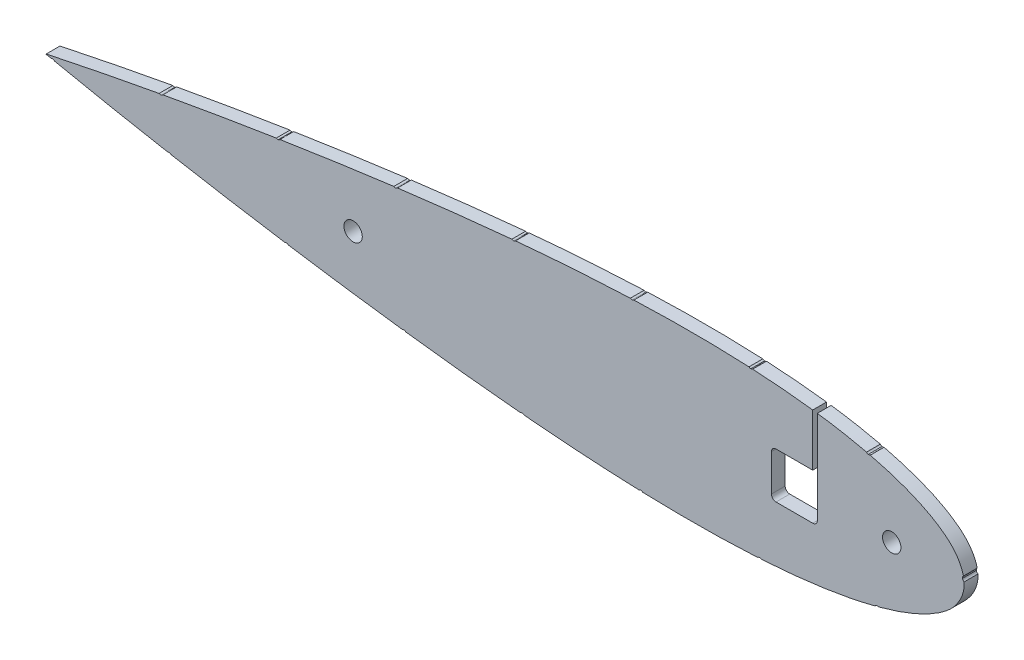
from build123d import *

# Parameters (mm, degrees)
SKETCH1_R           = 2
BOSS_EXTRUDE1_DEPTH = 3
SKETCH2_W           = 1
SKETCH2_H           = 17.978666844
CUT_EXTRUDE1_DEPTH  = 10


with BuildPart() as part:
    # Sketch1 → Boss-Extrude1 (new body)
    with BuildSketch(Plane.XY):
        with BuildLine():
            Line((-200, -0.026021313), (-200, 0.026021305))
            add(Edge.make_bspline(
                [(-200, 0.026021305), (-196.133660298, 0.824460007), (-188.973100367, 2.314029776), (-175.197231938, 4.95350612), (-158.682087923, 7.864416996), (-138.848303334, 10.963035098), (-119.017582397, 13.652387002), (-99.186590163, 15.851924276), (-79.350823181, 17.41083287), (-62.801573061, 17.964567123), (-49.570059005, 17.74356646), (-39.638389621, 17.155457266), (-29.688048318, 16.020003739), (-21.406431266, 14.43331701), (-14.801094645, 12.546196453), (-9.75689383, 10.639636938), (-5.531834741, 8.343752603), (-1.645401824, 5.168264306), (1.073716587, 0), (-1.645401824, -5.168264306), (-5.53183474, -8.343752603), (-9.756893829, -10.639636938), (-14.801094645, -12.546196453), (-21.406431266, -14.43331701), (-29.688048318, -16.02000374), (-39.63838962, -17.155457267), (-49.570059005, -17.743566462), (-62.801573061, -17.964567125), (-79.350823181, -17.410832873), (-99.186590162, -15.85192428), (-119.017582396, -13.652387007), (-138.848303334, -10.963035103), (-158.682087923, -7.864417002), (-175.197231937, -4.953506127), (-188.973100367, -2.314029784), (-196.133660298, -0.824460015), (-200, -0.026021313)],
                knots=[-0.004189875, -0.004189875, -0.004189875, -0.004189875, 0.024603844, 0.049152359, 0.098108667, 0.146905312, 0.195554797, 0.244056277, 0.292409554, 0.340643731, 0.364754111, 0.3889056, 0.413178108, 0.437756239, 0.450304697, 0.463229879, 0.477067953, 0.485035559, 0.5, 0.514964441, 0.522932047, 0.536770121, 0.549695303, 0.562243761, 0.586821892, 0.6110944, 0.635245889, 0.659356269, 0.707590446, 0.755943723, 0.804445203, 0.853094688, 0.901891333, 0.950847641, 0.975396156, 1.004189875, 1.004189875, 1.004189875, 1.004189875], degree=3))
        make_face()
        with Locations((-133.108640526, 0)):
            Circle(SKETCH1_R, mode=Mode.SUBTRACT)
        with Locations((-15.792378059, 0)):
            Circle(SKETCH1_R, mode=Mode.SUBTRACT)
        with BuildLine():
            Line((-32, -4), (-32, 4))
            ThreePointArc((-32, 4), (-32.292893219, 4.707106781), (-33, 5))
            Line((-33, 5), (-41, 5))
            ThreePointArc((-41, 5), (-41.707106781, 4.707106781), (-42, 4))
            Line((-42, 4), (-42, -4))
            ThreePointArc((-42, -4), (-41.707106781, -4.707106781), (-41, -5))
            Line((-41, -5), (-33, -5))
            ThreePointArc((-33, -5), (-32.292893219, -4.707106781), (-32, -4))
        make_face(mode=Mode.SUBTRACT)
    extrude(amount=BOSS_EXTRUDE1_DEPTH)

    # Sketch2 → Cut-Extrude1 (cut)
    with BuildSketch(Plane.XY.offset(3)):
        with Locations((-32.5, 11.321644193)):
            Rectangle(SKETCH2_W, SKETCH2_H)
        with BuildLine():
            add(Edge.make_bspline(
                [(-198.698716016, -1.42218076), (-198.657778251, -1.428824714), (-198.577801143, -1.441804518), (-198.456443716, -1.429500865), (-198.340152416, -1.395058585), (-198.231567162, -1.336603625), (-198.135060868, -1.260229332), (-198.058638463, -1.165294941), (-197.998864973, -1.057968244), (-197.978922981, -0.978027066), (-197.968754168, -0.93726349)],
                knots=[0, 0, 0, 0, 1.017083743, 1.987001844, 2.972391076, 3.986042786, 5.004656253, 5.979834707, 6.969878046, 8, 8, 8, 8], degree=3))
            add(Edge.make_bspline(
                [(-197.968754168, -0.93726349), (-197.962244326, -0.896346586), (-197.949457917, -0.815979), (-197.960020188, -0.694255872), (-197.996866616, -0.578352688), (-198.053356638, -0.468616036), (-198.129812011, -0.371935529), (-198.220976357, -0.29162283), (-198.328120385, -0.233724306), (-198.40662668, -0.212879634), (-198.446642127, -0.202254896)],
                knots=[0, 0, 0, 0, 1.019051807, 2.001586779, 2.979565923, 4.002845271, 5.029175072, 6.001582509, 6.981386527, 8, 8, 8, 8], degree=3))
            add(Edge.make_bspline(
                [(-198.446642127, -0.202254896), (-198.487587346, -0.195487057), (-198.567815263, -0.182226176), (-198.688931563, -0.196373323), (-198.805135937, -0.23159725), (-198.913393811, -0.29097891), (-199.00985413, -0.368622999), (-199.090301245, -0.460772688), (-199.146699034, -0.569654911), (-199.167796095, -0.64799544), (-199.178554798, -0.687946147)],
                knots=[0, 0, 0, 0, 1.017323363, 1.993339767, 2.969660132, 3.993090107, 5.011943554, 6.005958459, 6.983114227, 8, 8, 8, 8], degree=3))
            add(Edge.make_bspline(
                [(-199.178554798, -0.687946147), (-199.184698424, -0.729527004), (-199.196742327, -0.811041702), (-199.187056704, -0.934091433), (-199.15165593, -1.051130615), (-199.093558972, -1.159956573), (-199.016694835, -1.255336782), (-198.924848993, -1.334354229), (-198.817023536, -1.390345997), (-198.738672223, -1.411429149), (-198.698716016, -1.42218076)],
                knots=[0, 0, 0, 0, 1.03204317, 2.023207143, 3.008371278, 4.021791435, 5.040172216, 6.006883534, 6.98358598, 8, 8, 8, 8], degree=3))
        make_face()
        with BuildLine():
            add(Edge.make_bspline(
                [(-173.314476827, -6.388594177), (-173.27383976, -6.394547538), (-173.194310919, -6.406198573), (-173.07471371, -6.392626373), (-172.959485846, -6.358924655), (-172.852952065, -6.299031619), (-172.759020556, -6.220685562), (-172.681130424, -6.127606238), (-172.625977419, -6.018285902), (-172.605797416, -5.939174964), (-172.595480194, -5.898728732)],
                knots=[0, 0, 0, 0, 1.014936559, 1.986283321, 2.958172497, 3.976367764, 4.993083094, 5.978741162, 6.966611879, 8, 8, 8, 8], degree=3))
            add(Edge.make_bspline(
                [(-172.595480194, -5.898728732), (-172.589470542, -5.858086871), (-172.57761195, -5.777890019), (-172.592328787, -5.657687345), (-172.626324105, -5.541650662), (-172.685255776, -5.433954124), (-172.762956357, -5.339144487), (-172.854200786, -5.259991861), (-172.961576286, -5.203444427), (-173.039926545, -5.183841072), (-173.079964383, -5.173823543)],
                knots=[0, 0, 0, 0, 1.014921097, 2.002700549, 2.974574918, 4.000782688, 5.023610173, 6.001739072, 6.978866854, 8, 8, 8, 8], degree=3))
            add(Edge.make_bspline(
                [(-173.079964383, -5.173823543), (-173.120595835, -5.167862414), (-173.200772149, -5.156099573), (-173.321037046, -5.170106506), (-173.436478112, -5.206717149), (-173.542378614, -5.268073584), (-173.638992951, -5.34429013), (-173.713596434, -5.439483616), (-173.771876546, -5.545893336), (-173.790142797, -5.624759087), (-173.799481331, -5.665078826)],
                knots=[0, 0, 0, 0, 1.014449737, 2.001770434, 2.971023001, 3.99807325, 5.020425703, 6.001709555, 6.978383529, 8, 8, 8, 8], degree=3))
            add(Edge.make_bspline(
                [(-173.799481331, -5.665078826), (-173.805605356, -5.706160061), (-173.81768626, -5.787201286), (-173.804357912, -5.908925769), (-173.767901421, -6.025025296), (-173.709928304, -6.132667289), (-173.63224173, -6.226546831), (-173.540623236, -6.30397201), (-173.432640285, -6.358616665), (-173.354458092, -6.378451119), (-173.314476827, -6.388594177)],
                knots=[0, 0, 0, 0, 1.025765707, 2.023534839, 3.0019132, 4.027092756, 5.032139768, 6.005204792, 6.979889984, 8, 8, 8, 8], degree=3))
        make_face()
        with BuildLine():
            add(Edge.make_bspline(
                [(-147.766049435, -10.680380496), (-147.724906193, -10.684693128), (-147.644705822, -10.693099725), (-147.52436874, -10.67833883), (-147.410562319, -10.637724911), (-147.304155217, -10.575801485), (-147.211619457, -10.493919138), (-147.137731216, -10.396834669), (-147.084144842, -10.285918744), (-147.067192483, -10.205369326), (-147.058491793, -10.164027851)],
                knots=[0, 0, 0, 0, 1.016544963, 1.981547422, 2.95626941, 3.974200754, 4.995989429, 5.978674654, 6.962567667, 8, 8, 8, 8], degree=3))
            add(Edge.make_bspline(
                [(-147.058491793, -10.164027851), (-147.054231589, -10.122881772), (-147.045880715, -10.042227016), (-147.060150268, -9.921077354), (-147.099683593, -9.805867536), (-147.162621366, -9.699841354), (-147.242197197, -9.605526819), (-147.338127659, -9.530580365), (-147.447946942, -9.477942159), (-147.526737739, -9.460232562), (-147.566939675, -9.451196481)],
                knots=[0, 0, 0, 0, 1.018597505, 1.996660093, 2.983144274, 4.003130959, 5.022898425, 6.011721769, 6.985507986, 8, 8, 8, 8], degree=3))
            add(Edge.make_bspline(
                [(-147.566939675, -9.451196481), (-147.608104048, -9.446795746), (-147.689000444, -9.438147405), (-147.809698903, -9.454474268), (-147.924804559, -9.494023442), (-148.029163117, -9.559784023), (-148.124062563, -9.639259237), (-148.196686925, -9.73716852), (-148.252638694, -9.845813978), (-148.26895623, -9.925682955), (-148.277325984, -9.966650155)],
                knots=[0, 0, 0, 0, 1.016415999, 1.997464924, 2.972063253, 3.990885665, 5.018844379, 6.001404936, 6.974860488, 8, 8, 8, 8], degree=3))
            add(Edge.make_bspline(
                [(-148.277325984, -9.966650155), (-148.282127643, -10.008740234), (-148.291458405, -10.090531251), (-148.275059019, -10.213067165), (-148.233986441, -10.328093781), (-148.171761803, -10.434570666), (-148.091404406, -10.527295465), (-147.994933668, -10.600495534), (-147.886313223, -10.655710776), (-147.806503136, -10.672082225), (-147.766049435, -10.680380496)],
                knots=[0, 0, 0, 0, 1.038609022, 2.0182639, 3.008511575, 4.024867508, 5.034649745, 6.004359402, 6.988460601, 8, 8, 8, 8], degree=3))
        make_face()
        with BuildLine():
            add(Edge.make_bspline(
                [(-122.131403372, -14.298809703), (-122.090349434, -14.301906436), (-122.00985955, -14.307977855), (-121.890507949, -14.287873332), (-121.777914523, -14.245051666), (-121.674548945, -14.179883685), (-121.583890754, -14.097124207), (-121.513904876, -13.998110627), (-121.461252672, -13.887203533), (-121.447289905, -13.80628492), (-121.440104846, -13.76464525)],
                knots=[0, 0, 0, 0, 1.015022789, 1.990042171, 2.964140273, 3.976505931, 4.994472955, 5.978125389, 6.959569504, 8, 8, 8, 8], degree=3))
            add(Edge.make_bspline(
                [(-121.440104846, -13.76464525), (-121.436796637, -13.723101712), (-121.430347563, -13.642116082), (-121.451077465, -13.522033203), (-121.492565068, -13.408493059), (-121.558727606, -13.304837331), (-121.640421569, -13.213621595), (-121.737129573, -13.140989579), (-121.847680145, -13.09201763), (-121.926610678, -13.076851541), (-121.967037178, -13.0690838)],
                knots=[0, 0, 0, 0, 1.02917971, 2.006299243, 2.992527683, 4.007073935, 5.033914597, 6.012801283, 6.982200093, 8, 8, 8, 8], degree=3))
            add(Edge.make_bspline(
                [(-121.967037178, -13.0690838), (-122.007941176, -13.065491161), (-122.088690478, -13.058398869), (-122.208994441, -13.077700299), (-122.322055218, -13.122630734), (-122.425267693, -13.189038454), (-122.516406493, -13.271779882), (-122.586308025, -13.370869315), (-122.638664005, -13.480824268), (-122.652409735, -13.560774114), (-122.659401435, -13.601440223)],
                knots=[0, 0, 0, 0, 1.012413812, 1.99862393, 2.97981436, 4.00105753, 5.018998664, 6.002626082, 6.984045237, 8, 8, 8, 8], degree=3))
            add(Edge.make_bspline(
                [(-122.659401435, -13.601440223), (-122.662611946, -13.643411038), (-122.668855355, -13.725030757), (-122.651724176, -13.846857056), (-122.607146648, -13.959983741), (-122.5420821, -14.064112185), (-122.459385096, -14.15418794), (-122.361353863, -14.224769707), (-122.251538591, -14.276206375), (-122.171902617, -14.291189808), (-122.131403372, -14.298809703)],
                knots=[0, 0, 0, 0, 1.037472026, 2.017548995, 3.007322432, 4.018277869, 5.034826871, 6.005725454, 6.985802423, 8, 8, 8, 8], degree=3))
        make_face()
        with BuildLine():
            add(Edge.make_bspline(
                [(-96.365247494, -17.114692511), (-96.323889926, -17.116481886), (-96.242916598, -17.119985275), (-96.124245578, -17.093652731), (-96.012464882, -17.047011888), (-95.911953089, -16.976062033), (-95.824468836, -16.888838226), (-95.758904794, -16.785317527), (-95.712074014, -16.670858712), (-95.700781035, -16.58893628), (-95.695018768, -16.547135184)],
                knots=[0, 0, 0, 0, 1.013456929, 1.984231283, 2.958728731, 3.973133191, 4.988120307, 5.974751867, 6.966612828, 8, 8, 8, 8], degree=3))
            add(Edge.make_bspline(
                [(-95.695018768, -16.547135184), (-95.693311564, -16.505796153), (-95.689950059, -16.424399108), (-95.715381359, -16.305021015), (-95.762879061, -16.192748204), (-95.832943542, -16.090908781), (-95.919821907, -16.002641888), (-96.021016968, -15.935256492), (-96.133896413, -15.888820393), (-96.21436451, -15.877789682), (-96.255674559, -15.872126826)],
                knots=[0, 0, 0, 0, 1.015443082, 1.999419494, 2.975826744, 4.000868901, 5.024752326, 6.006841917, 6.976768938, 8, 8, 8, 8], degree=3))
            add(Edge.make_bspline(
                [(-96.255674559, -15.872126826), (-96.296994639, -15.870468906), (-96.378354368, -15.867204443), (-96.497870331, -15.891899187), (-96.608995348, -15.941996722), (-96.709263444, -16.013444952), (-96.796254293, -16.101067165), (-96.864095069, -16.202174354), (-96.910191921, -16.315760548), (-96.921385786, -16.396669603), (-96.927098192, -16.437958769)],
                knots=[0, 0, 0, 0, 1.015229926, 1.998999788, 2.971853695, 3.996680681, 5.013443471, 5.995326907, 6.976983728, 8, 8, 8, 8], degree=3))
            add(Edge.make_bspline(
                [(-96.927098192, -16.437958769), (-96.929088262, -16.480273847), (-96.932962254, -16.562646983), (-96.907142264, -16.68368082), (-96.859159195, -16.796150485), (-96.788233478, -16.89753663), (-96.700638344, -16.984089119), (-96.599963773, -17.05162614), (-96.487010103, -17.097982189), (-96.406552272, -17.109023972), (-96.365247494, -17.114692511)],
                knots=[0, 0, 0, 0, 1.036141522, 2.017016871, 3.007168552, 4.020357798, 5.034129003, 6.013123477, 6.979993714, 8, 8, 8, 8], degree=3))
        make_face()
        with BuildLine():
            add(Edge.make_bspline(
                [(-70.495134128, -18.754112945), (-70.453563783, -18.753306935), (-70.372581357, -18.751736763), (-70.256018236, -18.718317424), (-70.14731119, -18.66586755), (-70.051055215, -18.589089289), (-69.970970199, -18.495780371), (-69.910034508, -18.390197328), (-69.870921185, -18.27326703), (-69.864944583, -18.190812229), (-69.861891672, -18.148693458)],
                knots=[0, 0, 0, 0, 1.020035374, 1.987112173, 2.958782459, 3.976632821, 4.995139179, 5.970468678, 6.963294272, 8, 8, 8, 8], degree=3))
            add(Edge.make_bspline(
                [(-69.861891672, -18.148693458), (-69.862763045, -18.107137572), (-69.864470391, -18.025714028), (-69.897272234, -17.908515103), (-69.949965615, -17.799283449), (-70.027175146, -17.703664131), (-70.118563259, -17.621344993), (-70.223317709, -17.559404315), (-70.338980693, -17.520406008), (-70.419959905, -17.514441572), (-70.461086241, -17.511412457)],
                knots=[0, 0, 0, 0, 1.022793349, 2.004035206, 2.978332697, 3.998935126, 5.017854659, 6.001223378, 6.984895559, 8, 8, 8, 8], degree=3))
            add(Edge.make_bspline(
                [(-70.461086241, -17.511412457), (-70.502628251, -17.512280421), (-70.583555477, -17.513971287), (-70.701008752, -17.546656982), (-70.80825146, -17.602659275), (-70.903922986, -17.680289293), (-70.985652353, -17.772171156), (-71.04596229, -17.877972258), (-71.085323848, -17.993199005), (-71.091228911, -18.07420924), (-71.094227874, -18.115351331)],
                knots=[0, 0, 0, 0, 1.023280882, 1.993434686, 2.980682337, 3.992734567, 5.021837862, 6.000270626, 6.984411691, 8, 8, 8, 8], degree=3))
            add(Edge.make_bspline(
                [(-71.094227874, -18.115351331), (-71.093357365, -18.157381129), (-71.091651756, -18.239731086), (-71.059358958, -18.358847881), (-71.00507588, -18.468579405), (-70.928283959, -18.564990652), (-70.836387945, -18.645423589), (-70.732238432, -18.706242958), (-70.617247292, -18.74514349), (-70.536263028, -18.751091945), (-70.495134128, -18.754112945)],
                knots=[0, 0, 0, 0, 1.032763593, 2.023517646, 3.012470053, 4.030960965, 5.040364569, 6.005358633, 6.986995702, 8, 8, 8, 8], degree=3))
        make_face()
        with BuildLine():
            add(Edge.make_bspline(
                [(-44.540683937, -18.522989647), (-44.499767552, -18.518202882), (-44.4194148, -18.508802499), (-44.305113986, -18.467034113), (-44.20223296, -18.402780755), (-44.112947554, -18.318480934), (-44.039071245, -18.2200379), (-43.991170952, -18.107590796), (-43.961111193, -17.987963005), (-43.963086345, -17.905125102), (-43.96409121, -17.86298103)],
                knots=[0, 0, 0, 0, 1.011046661, 1.985522006, 2.965834628, 3.976294835, 4.992604354, 5.969661498, 6.9670582, 8, 8, 8, 8], degree=3))
            add(Edge.make_bspline(
                [(-43.96409121, -17.86298103), (-43.968949565, -17.822096869), (-43.978547557, -17.741327591), (-44.019458637, -17.62656265), (-44.085224681, -17.524161806), (-44.168575899, -17.433682412), (-44.267117627, -17.359100024), (-44.378044537, -17.308520344), (-44.496234228, -17.278880964), (-44.577593441, -17.280459107), (-44.618739646, -17.281257229)],
                knots=[0, 0, 0, 0, 1.013655101, 2.002540536, 2.974332368, 3.99727618, 5.024579147, 6.000042749, 6.988551538, 8, 8, 8, 8], degree=3))
            add(Edge.make_bspline(
                [(-44.618739646, -17.281257229), (-44.659627562, -17.286091807), (-44.739924407, -17.295586088), (-44.854410883, -17.336588602), (-44.955816552, -17.403427683), (-45.044364834, -17.488408658), (-45.118356461, -17.587328618), (-45.167561087, -17.698394216), (-45.198469601, -17.816687049), (-45.196511771, -17.898126906), (-45.195510123, -17.939792488)],
                knots=[0, 0, 0, 0, 1.014489377, 1.99228291, 2.970152734, 3.991311874, 5.01108203, 5.99776167, 6.975631494, 8, 8, 8, 8], degree=3))
            add(Edge.make_bspline(
                [(-45.195510123, -17.939792488), (-45.190647774, -17.981705377), (-45.181153364, -18.063546097), (-45.138921979, -18.179627975), (-45.075177081, -18.284407996), (-44.988737, -18.372848558), (-44.890947545, -18.446248649), (-44.780665241, -18.495804332), (-44.663201553, -18.525389171), (-44.581834239, -18.523795581), (-44.540683937, -18.522989647)],
                knots=[0, 0, 0, 0, 1.035623612, 2.0221985, 3.013794921, 4.031730307, 5.048281094, 6.004715682, 6.990914804, 8, 8, 8, 8], degree=3))
        make_face()
        with BuildLine():
            add(Edge.make_bspline(
                [(-18.766047409, -14.776053106), (-18.726430121, -14.763093483), (-18.649060915, -14.737784437), (-18.545436998, -14.673336124), (-18.457066041, -14.590781911), (-18.385859349, -14.491047634), (-18.33490107, -14.379094323), (-18.306568202, -14.260154785), (-18.304516006, -14.136522259), (-18.321060429, -14.05579838), (-18.329530252, -14.01447225)],
                knots=[0, 0, 0, 0, 1.021838797, 1.995564641, 2.972021413, 3.978690765, 4.988295019, 5.978293441, 6.964998844, 8, 8, 8, 8], degree=3))
            add(Edge.make_bspline(
                [(-18.329530252, -14.01447225), (-18.34227244, -13.975300664), (-18.36745469, -13.897886276), (-18.431918143, -13.79422239), (-18.515183566, -13.705230898), (-18.615636383, -13.633033054), (-18.727185937, -13.579965836), (-18.845467521, -13.54981877), (-18.967679832, -13.544803999), (-19.047482934, -13.562269914), (-19.088120926, -13.571164051)],
                knots=[0, 0, 0, 0, 1.010663379, 1.997363258, 2.974631646, 3.993181824, 5.023377087, 5.996390516, 6.979705479, 8, 8, 8, 8], degree=3))
            add(Edge.make_bspline(
                [(-19.088120926, -13.571164051), (-19.127264944, -13.583939206), (-19.204624849, -13.609186608), (-19.308379598, -13.67298178), (-19.395974382, -13.758014954), (-19.465768415, -13.860099358), (-19.517068622, -13.973075268), (-19.546684988, -14.091529983), (-19.549850578, -14.213849601), (-19.532681024, -14.293401127), (-19.523910337, -14.33403826)],
                knots=[0, 0, 0, 0, 1.010480825, 1.99700248, 2.965261353, 3.994047373, 5.021320419, 6.003025338, 6.979889772, 8, 8, 8, 8], degree=3))
            add(Edge.make_bspline(
                [(-19.523910337, -14.33403826), (-19.511276621, -14.374391151), (-19.486617909, -14.453152637), (-19.420850809, -14.557776425), (-19.338357962, -14.647946032), (-19.236619635, -14.717636463), (-19.125101505, -14.768833403), (-19.007657006, -14.797723453), (-18.885829244, -14.802214534), (-18.80668766, -14.784929302), (-18.766047409, -14.776053106)],
                knots=[0, 0, 0, 0, 1.036080969, 2.022241198, 3.010800118, 4.022960242, 5.032851028, 6.014196287, 6.980263503, 8, 8, 8, 8], degree=3))
        make_face()
        with BuildLine():
            add(Edge.make_bspline(
                [(0.855774028, 1.068338446), (0.848776003, 1.109017523), (0.835035451, 1.188890479), (0.78327878, 1.298374183), (0.712926067, 1.396822882), (0.621653965, 1.478522501), (0.518436797, 1.545091294), (0.404937176, 1.588408087), (0.283332954, 1.605749781), (0.201396156, 1.599432712), (0.159309605, 1.596187971)],
                knots=[0, 0, 0, 0, 1.014719943, 1.992392375, 2.958557865, 3.98503947, 4.996226357, 5.975727355, 6.960239397, 8, 8, 8, 8], degree=3))
            add(Edge.make_bspline(
                [(0.159309605, 1.596187971), (0.118639917, 1.589162661), (0.038302384, 1.575285101), (-0.072130602, 1.523321478), (-0.171394371, 1.452959938), (-0.254449583, 1.362297028), (-0.322423721, 1.259605278), (-0.364316198, 1.146121896), (-0.385650752, 1.02690946), (-0.379407755, 0.946518486), (-0.376209444, 0.905333887)],
                knots=[0, 0, 0, 0, 1.016640156, 2.008236801, 2.98768293, 4.009609709, 5.03175617, 6.013110734, 6.982109138, 8, 8, 8, 8], degree=3))
            add(Edge.make_bspline(
                [(-0.376209444, 0.905333887), (-0.368562841, 0.864832411), (-0.353454214, 0.784807118), (-0.302341696, 0.674580449), (-0.231436564, 0.575930605), (-0.140280064, 0.493423562), (-0.035300569, 0.428684278), (0.077771468, 0.382709194), (0.198956509, 0.366210797), (0.279915093, 0.371787366), (0.321030895, 0.374619494)],
                knots=[0, 0, 0, 0, 1.01379397, 2.003116137, 2.968889617, 3.994954739, 5.014025868, 6.000331341, 6.98444393, 8, 8, 8, 8], degree=3))
            add(Edge.make_bspline(
                [(0.321030895, 0.374619494), (0.362676432, 0.381847444), (0.443988007, 0.395959783), (0.555283589, 0.44829647), (0.655038134, 0.518552357), (0.736863711, 0.610330705), (0.803725396, 0.71347278), (0.845996987, 0.826872206), (0.866781689, 0.946649682), (0.859485948, 1.027303489), (0.855774028, 1.068338446)],
                knots=[0, 0, 0, 0, 1.037152729, 2.025007431, 3.000757468, 4.025300625, 5.034577948, 6.012229218, 6.988664126, 8, 8, 8, 8], degree=3))
        make_face()
        with BuildLine():
            add(Edge.make_bspline(
                [(-20.620263047, 15.240646492), (-20.660968044, 15.248471876), (-20.740805911, 15.263820407), (-20.862343223, 15.255145249), (-20.979137547, 15.223438843), (-21.088342471, 15.167878717), (-21.18663641, 15.094293296), (-21.267330025, 15.003075966), (-21.330029155, 14.896979313), (-21.352633363, 14.817681841), (-21.364200928, 14.777101842)],
                knots=[0, 0, 0, 0, 1.01727483, 1.995260003, 2.969823377, 3.981243339, 4.994936076, 5.976104161, 6.964283641, 8, 8, 8, 8], degree=3))
            add(Edge.make_bspline(
                [(-21.364200928, 14.777101842), (-21.372052259, 14.736390863), (-21.387451684, 14.656541262), (-21.378379065, 14.534720259), (-21.347814614, 14.416977913), (-21.292753557, 14.306559179), (-21.220331261, 14.206702631), (-21.128989723, 14.126390564), (-21.023862583, 14.064400271), (-20.945890812, 14.041139244), (-20.906010177, 14.029241803)],
                knots=[0, 0, 0, 0, 1.01783833, 1.996365239, 2.980496325, 3.999721009, 5.019310209, 6.001021793, 6.977572031, 8, 8, 8, 8], degree=3))
            add(Edge.make_bspline(
                [(-20.906010177, 14.029241803), (-20.865054423, 14.021865038), (-20.785298439, 14.00749975), (-20.664208802, 14.017052991), (-20.547295388, 14.04831001), (-20.437806775, 14.105422301), (-20.339477072, 14.180094075), (-20.258025298, 14.270747081), (-20.198512309, 14.376784501), (-20.17523302, 14.45412575), (-20.163392118, 14.493465017)],
                knots=[0, 0, 0, 0, 1.024379987, 1.994846304, 2.972367305, 3.996747292, 5.024548318, 6.008694075, 6.987131501, 8, 8, 8, 8], degree=3))
            add(Edge.make_bspline(
                [(-20.163392118, 14.493465017), (-20.156182881, 14.534823912), (-20.142042213, 14.615947945), (-20.14558745, 14.73899923), (-20.179313343, 14.856383121), (-20.232813996, 14.966773095), (-20.307145225, 15.065080268), (-20.397857104, 15.145453944), (-20.502571059, 15.207689272), (-20.580566337, 15.229530245), (-20.620263047, 15.240646492)],
                knots=[0, 0, 0, 0, 1.032581978, 2.025373636, 2.999756313, 4.018227857, 5.031732643, 6.012718807, 6.988547439, 8, 8, 8, 8], degree=3))
        make_face()
        with BuildLine():
            add(Edge.make_bspline(
                [(-46.428550572, 18.627149519), (-46.469652033, 18.627131816), (-46.550754027, 18.627096885), (-46.668657977, 18.598506219), (-46.777118782, 18.544596171), (-46.874361663, 18.470331718), (-46.958809779, 18.380566366), (-47.021658824, 18.27582356), (-47.06166974, 18.159357034), (-47.069944692, 18.07740467), (-47.074182522, 18.035434605)],
                knots=[0, 0, 0, 0, 1.01019419, 1.993329679, 2.957234023, 3.974902007, 4.993956114, 5.975579086, 6.963238228, 8, 8, 8, 8], degree=3))
            add(Edge.make_bspline(
                [(-47.074182522, 18.035434605), (-47.074182334, 17.994327037), (-47.074181964, 17.913212994), (-47.045238108, 17.794984657), (-46.991807227, 17.685533842), (-46.918245034, 17.586615576), (-46.827698758, 17.50289722), (-46.725085968, 17.438113277), (-46.610656359, 17.396526344), (-46.530003035, 17.388566731), (-46.488991622, 17.384519347)],
                knots=[0, 0, 0, 0, 1.01271472, 1.998303225, 2.974988035, 4.004157658, 5.025754401, 6.004043277, 6.985075879, 8, 8, 8, 8], degree=3))
            add(Edge.make_bspline(
                [(-46.488991622, 17.384519347), (-46.447852239, 17.385169853), (-46.36674809, 17.386452291), (-46.247962807, 17.414556896), (-46.139416368, 17.469806752), (-46.040766261, 17.543643895), (-45.958709686, 17.6358917), (-45.896050179, 17.740024325), (-45.853763045, 17.854346378), (-45.845888092, 17.935044819), (-45.841883757, 17.976079173)],
                knots=[0, 0, 0, 0, 1.01357222, 1.998204819, 2.980412583, 3.999630263, 5.022861345, 6.005979124, 6.986060238, 8, 8, 8, 8], degree=3))
            add(Edge.make_bspline(
                [(-45.841883757, 17.976079173), (-45.841549551, 18.018224298), (-45.840892639, 18.101064269), (-45.872350667, 18.219935913), (-45.92291771, 18.330781664), (-45.998302676, 18.427688743), (-46.087782374, 18.512292394), (-46.192215398, 18.574745137), (-46.30706035, 18.614847182), (-46.387559593, 18.622998693), (-46.428550572, 18.627149519)],
                knots=[0, 0, 0, 0, 1.033356646, 2.031153917, 2.998154051, 4.014871735, 5.032974247, 6.013680577, 6.988547287, 8, 8, 8, 8], degree=3))
        make_face()
        with BuildLine():
            add(Edge.make_bspline(
                [(-72.375466935, 18.701431712), (-72.416573629, 18.698058263), (-72.497514168, 18.691415822), (-72.612078833, 18.651417635), (-72.716264169, 18.589895011), (-72.806407704, 18.506984575), (-72.882364089, 18.410289026), (-72.936578037, 18.300947013), (-72.967403505, 18.181831279), (-72.968433667, 18.099488582), (-72.968959442, 18.05746249)],
                knots=[0, 0, 0, 0, 1.013395961, 1.995412564, 2.960779728, 3.977984359, 4.996869055, 5.975699992, 6.966837105, 8, 8, 8, 8], degree=3))
            add(Edge.make_bspline(
                [(-72.968959442, 18.05746249), (-72.96544176, 18.016401612), (-72.958525586, 17.935671133), (-72.920533908, 17.820131385), (-72.858731251, 17.715176467), (-72.776379519, 17.623952721), (-72.679986496, 17.54717695), (-72.572271011, 17.492109277), (-72.454533598, 17.460451622), (-72.373595129, 17.459467424), (-72.332047348, 17.45896221)],
                knots=[0, 0, 0, 0, 1.015964745, 1.997505321, 2.976300749, 4.005785491, 5.018212846, 6.00582643, 6.97633983, 8, 8, 8, 8], degree=3))
            add(Edge.make_bspline(
                [(-72.332047348, 17.45896221), (-72.290927417, 17.462314826), (-72.209960816, 17.468916245), (-72.095162787, 17.509362195), (-71.989926998, 17.570092345), (-71.899901647, 17.653680603), (-71.822651796, 17.749958703), (-71.772872357, 17.860583043), (-71.737603749, 17.977179856), (-71.737103787, 18.05845187), (-71.736847667, 18.100085831)],
                knots=[0, 0, 0, 0, 1.015395747, 1.999350215, 2.977597462, 3.996809397, 5.01770471, 6.002872438, 6.976913138, 8, 8, 8, 8], degree=3))
            add(Edge.make_bspline(
                [(-71.736847667, 18.100085831), (-71.740268663, 18.142175575), (-71.746965854, 18.224573552), (-71.787093598, 18.341168524), (-71.848968775, 18.446175141), (-71.929788951, 18.538937397), (-72.027195267, 18.614447229), (-72.135608698, 18.668057343), (-72.252949805, 18.700020208), (-72.333908679, 18.700952925), (-72.375466935, 18.701431712)],
                knots=[0, 0, 0, 0, 1.035907175, 2.027968017, 3.002546241, 4.020268065, 5.037334399, 6.014418458, 6.980750337, 8, 8, 8, 8], degree=3))
        make_face()
        with BuildLine():
            add(Edge.make_bspline(
                [(-98.246170693, 16.940744336), (-98.287474331, 16.934894979), (-98.367929942, 16.923500981), (-98.480027991, 16.876017968), (-98.582064347, 16.810221026), (-98.667489943, 16.721123441), (-98.737920037, 16.619878198), (-98.786699208, 16.507563478), (-98.810620817, 16.386035098), (-98.806475884, 16.303267389), (-98.804358479, 16.260986172)],
                knots=[0, 0, 0, 0, 1.019584346, 1.986054622, 2.959890179, 3.980124563, 4.992894689, 5.972537486, 6.964287093, 8, 8, 8, 8], degree=3))
            add(Edge.make_bspline(
                [(-98.804358479, 16.260986172), (-98.798485917, 16.219698855), (-98.787046717, 16.139275038), (-98.739636586, 16.02634383), (-98.672217104, 15.924973695), (-98.584123545, 15.837846737), (-98.484047095, 15.76631129), (-98.371739595, 15.719463851), (-98.252868253, 15.692630151), (-98.171246886, 15.696717458), (-98.129888846, 15.698788522)],
                knots=[0, 0, 0, 0, 1.02339542, 1.993478236, 2.986919853, 4.004059474, 5.029266278, 5.99566988, 6.984393811, 8, 8, 8, 8], degree=3))
            add(Edge.make_bspline(
                [(-98.129888846, 15.698788522), (-98.088519024, 15.704477636), (-98.007832569, 15.715573513), (-97.89658212, 15.76539404), (-97.794254516, 15.830671391), (-97.70844291, 15.920010188), (-97.638807347, 16.022025993), (-97.591947885, 16.134604948), (-97.567153465, 16.254105182), (-97.570955631, 16.335484729), (-97.572886632, 16.376814874)],
                knots=[0, 0, 0, 0, 1.023518922, 1.996240499, 2.973834088, 3.998005556, 5.023336082, 6.00001802, 6.984271248, 8, 8, 8, 8], degree=3))
            add(Edge.make_bspline(
                [(-97.572886632, 16.376814874), (-97.578874928, 16.418583261), (-97.590610883, 16.500441591), (-97.638053926, 16.614659755), (-97.704195722, 16.717772157), (-97.792074369, 16.804724494), (-97.893473576, 16.87453744), (-98.004625604, 16.923228286), (-98.124191207, 16.946116655), (-98.204869904, 16.942563338), (-98.246170693, 16.940744336)],
                knots=[0, 0, 0, 0, 1.033099934, 2.0246852, 3.011042518, 4.025747511, 5.039870009, 6.020820943, 6.986824769, 8, 8, 8, 8], degree=3))
        make_face()
        with BuildLine():
            add(Edge.make_bspline(
                [(-123.98309955, 14.038653969), (-124.023742838, 14.031531316), (-124.10316606, 14.017612558), (-124.212058146, 13.965113142), (-124.309483978, 13.89464297), (-124.391821668, 13.804198998), (-124.456494824, 13.699839005), (-124.500641276, 13.586540003), (-124.517310021, 13.464650539), (-124.510756674, 13.383054976), (-124.507386786, 13.341096583)],
                knots=[0, 0, 0, 0, 1.016046001, 1.985509802, 2.957825313, 3.975857864, 4.988288687, 5.979506598, 6.96101389, 8, 8, 8, 8], degree=3))
            add(Edge.make_bspline(
                [(-124.507386786, 13.341096583), (-124.500236209, 13.300461684), (-124.486178127, 13.220573198), (-124.433469711, 13.110755092), (-124.362701079, 13.011831087), (-124.271799865, 12.928308738), (-124.168226182, 12.861871443), (-124.05496558, 12.819643336), (-123.935581995, 12.799915542), (-123.855109764, 12.806303107), (-123.814064831, 12.809561089)],
                knots=[0, 0, 0, 0, 1.016645896, 1.998732691, 2.98302925, 4.011980818, 5.033918719, 6.00865469, 6.984312543, 8, 8, 8, 8], degree=3))
            add(Edge.make_bspline(
                [(-123.814064831, 12.809561089), (-123.773588551, 12.817329102), (-123.693997735, 12.832603789), (-123.584468271, 12.884537545), (-123.486145125, 12.95534409), (-123.404769504, 13.047452156), (-123.340258536, 13.152426847), (-123.298688174, 13.266234744), (-123.278517884, 13.386450903), (-123.285260136, 13.467403796), (-123.288718737, 13.50893054)],
                knots=[0, 0, 0, 0, 1.015502108, 1.996839719, 2.96898714, 3.993509591, 5.014228291, 5.998230207, 6.973143781, 8, 8, 8, 8], degree=3))
            add(Edge.make_bspline(
                [(-123.288718737, 13.50893054), (-123.296061879, 13.550542589), (-123.31033185, 13.631407526), (-123.363404631, 13.74211439), (-123.433766745, 13.840859555), (-123.524735654, 13.923281662), (-123.628358645, 13.988029017), (-123.741502347, 14.030683032), (-123.861460879, 14.049883254), (-123.942200471, 14.042429638), (-123.98309955, 14.038653969)],
                knots=[0, 0, 0, 0, 1.039309004, 2.019695211, 3.002287356, 4.019157102, 5.03043152, 6.003479632, 6.988651759, 8, 8, 8, 8], degree=3))
        make_face()
        with BuildLine():
            add(Edge.make_bspline(
                [(-149.619775573, 10.365633866), (-149.660228152, 10.35724933), (-149.739554976, 10.340807398), (-149.847254578, 10.285045757), (-149.943848655, 10.212146276), (-150.02178572, 10.117536875), (-150.085736975, 10.012287166), (-150.125759552, 9.897076175), (-150.141917621, 9.774584655), (-150.132304993, 9.69281049), (-150.127358284, 9.650729082)],
                knots=[0, 0, 0, 0, 1.013285717, 1.987036196, 2.958419957, 3.976311709, 4.986294541, 5.978251776, 6.959597927, 8, 8, 8, 8], degree=3))
            add(Edge.make_bspline(
                [(-150.127358284, 9.650729082), (-150.118857809, 9.609788719), (-150.102285423, 9.529972064), (-150.045986973, 9.421507022), (-149.973051026, 9.323825228), (-149.877896074, 9.244672237), (-149.773336566, 9.179175613), (-149.658502492, 9.140386972), (-149.538344541, 9.123448502), (-149.457903183, 9.132473703), (-149.416743075, 9.137091703)],
                knots=[0, 0, 0, 0, 1.026554847, 2.001354377, 2.985271483, 4.014649424, 5.034878448, 6.010822334, 6.98218071, 8, 8, 8, 8], degree=3))
            add(Edge.make_bspline(
                [(-149.416743075, 9.137091703), (-149.376601409, 9.146307832), (-149.297450218, 9.164480161), (-149.1873754, 9.21689211), (-149.09219138, 9.293413782), (-149.011795741, 9.386905016), (-148.949266993, 9.493760476), (-148.910028122, 9.609027899), (-148.896164505, 9.730240195), (-148.904770176, 9.810865456), (-148.909160364, 9.851996487)],
                knots=[0, 0, 0, 0, 1.013093417, 1.997613891, 2.973643039, 4.002387828, 5.020968341, 6.006092537, 6.982806752, 8, 8, 8, 8], degree=3))
            add(Edge.make_bspline(
                [(-148.909160364, 9.851996487), (-148.917988598, 9.893314412), (-148.935189463, 9.973817946), (-148.98919108, 10.08450003), (-149.062896733, 10.181245531), (-149.156177666, 10.26172702), (-149.262665883, 10.322858093), (-149.376659998, 10.365491958), (-149.498083426, 10.378442887), (-149.578666211, 10.369960938), (-149.619775573, 10.365633866)],
                knots=[0, 0, 0, 0, 1.036395052, 2.019304315, 3.001006998, 4.011343256, 5.028256817, 6.009355654, 6.984471433, 8, 8, 8, 8], degree=3))
        make_face()
        with BuildLine():
            add(Edge.make_bspline(
                [(-175.156035052, 6.02013246), (-175.196027199, 6.009958717), (-175.274764867, 5.989928364), (-175.382540544, 5.933068635), (-175.473949621, 5.853313546), (-175.551365485, 5.757801625), (-175.611040839, 5.649916045), (-175.647218791, 5.532726471), (-175.659347643, 5.409965704), (-175.646702804, 5.328088537), (-175.640291226, 5.286572639)],
                knots=[0, 0, 0, 0, 1.011686308, 1.991836573, 2.960916479, 3.974281451, 5.000184868, 5.970484126, 6.970931983, 8, 8, 8, 8], degree=3))
            add(Edge.make_bspline(
                [(-175.640291226, 5.286572639), (-175.630006066, 5.24607339), (-175.60987437, 5.166802045), (-175.552064132, 5.058827481), (-175.474175715, 4.964890331), (-175.37821867, 4.887274827), (-175.27117341, 4.825808026), (-175.154851525, 4.790909566), (-175.033771181, 4.776695304), (-174.95317615, 4.789170152), (-174.912098217, 4.795528373)],
                knots=[0, 0, 0, 0, 1.025269627, 2.006815059, 2.984729608, 4.010071516, 5.029542059, 6.001222463, 6.981256663, 8, 8, 8, 8], degree=3))
            add(Edge.make_bspline(
                [(-174.912098217, 4.795528373), (-174.871564135, 4.805760502), (-174.792702167, 4.825667844), (-174.685178234, 4.884046239), (-174.590383461, 4.960680664), (-174.5144859, 5.058683477), (-174.455621314, 5.167321505), (-174.418538371, 5.283989104), (-174.407823547, 5.406412304), (-174.419827811, 5.48717561), (-174.42592915, 5.528224714)],
                knots=[0, 0, 0, 0, 1.023164577, 1.99064015, 2.9780502, 3.996949916, 5.013020659, 5.999757756, 6.983348313, 8, 8, 8, 8], degree=3))
            add(Edge.make_bspline(
                [(-174.42592915, 5.528224714), (-174.436554664, 5.569101186), (-174.457342692, 5.649072965), (-174.513071111, 5.759152193), (-174.591432187, 5.852957527), (-174.687719436, 5.929939669), (-174.79568167, 5.990469138), (-174.912946945, 6.024451911), (-175.034346905, 6.039031727), (-175.114951993, 6.02651303), (-175.156035052, 6.02013246)],
                knots=[0, 0, 0, 0, 1.033562989, 2.022089147, 2.996373909, 4.007414602, 5.030964981, 6.008641453, 6.985037997, 8, 8, 8, 8], degree=3))
        make_face()
        with BuildLine():
            add(Edge.make_bspline(
                [(-200.519648096, 1.066036541), (-200.559886471, 1.056436986), (-200.63844232, 1.037696141), (-200.746322355, 0.982141399), (-200.839302623, 0.905138173), (-200.915394506, 0.809430322), (-200.976347351, 0.703034053), (-201.011830938, 0.58670986), (-201.023556364, 0.46493327), (-201.012636303, 0.383971721), (-201.007053491, 0.342580639)],
                knots=[0, 0, 0, 0, 1.020187233, 1.991672716, 2.970526183, 3.984236906, 5.000896611, 5.984935689, 6.96981105, 8, 8, 8, 8], degree=3))
            add(Edge.make_bspline(
                [(-201.007053491, 0.342580639), (-200.997655727, 0.302225695), (-200.979296774, 0.223390501), (-200.920686433, 0.116836346), (-200.846117644, 0.021073277), (-200.749286465, -0.055810108), (-200.643452527, -0.117570894), (-200.528416612, -0.154806242), (-200.408239976, -0.168878847), (-200.327916885, -0.158037255), (-200.286973732, -0.152510962)],
                knots=[0, 0, 0, 0, 1.021056861, 1.994680386, 2.9822949, 4.007528479, 5.034515595, 6.000330523, 6.980706878, 8, 8, 8, 8], degree=3))
            add(Edge.make_bspline(
                [(-200.286973732, -0.152510962), (-200.24687813, -0.142470676), (-200.168508265, -0.122846183), (-200.061560581, -0.065564728), (-199.968293701, 0.011550354), (-199.890468593, 0.106955255), (-199.830798006, 0.215090317), (-199.795754855, 0.331296112), (-199.780480068, 0.452010534), (-199.792571016, 0.532105057), (-199.798724301, 0.572866491)],
                knots=[0, 0, 0, 0, 1.019303575, 1.99230538, 2.971367647, 3.995946549, 5.020671601, 6.004920585, 6.984670907, 8, 8, 8, 8], degree=3))
            add(Edge.make_bspline(
                [(-199.798724301, 0.572866491), (-199.808508015, 0.613562401), (-199.827613843, 0.69303417), (-199.883644368, 0.802320613), (-199.96089453, 0.895939896), (-200.055497127, 0.973719975), (-200.162016372, 1.034376279), (-200.278119715, 1.06892199), (-200.398781214, 1.084302624), (-200.478882977, 1.072197195), (-200.519648096, 1.066036541)],
                knots=[0, 0, 0, 0, 1.031132281, 2.013615316, 3.002914395, 4.009422569, 5.024867153, 6.007730098, 6.986100714, 8, 8, 8, 8], degree=3))
        make_face()
    extrude(amount=-CUT_EXTRUDE1_DEPTH, mode=Mode.SUBTRACT)


solid = part.part
